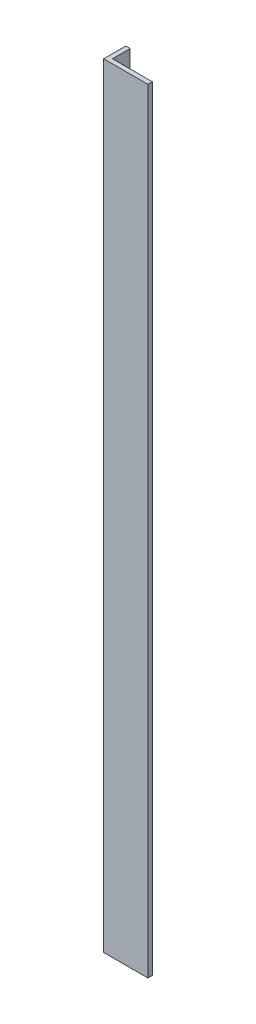
from build123d import *

# Parameters (mm, degrees)
BOSS_EXTRUDE1_DEPTH      = 300
BOSS_EXTRUDE1_DEPTH_BACK = 50
F_3_0_3_DIAMETER_HOLE3_D = 3
F_3_0_3_DIAMETER_HOLE4_D = 3


with BuildPart() as part:
    # Sketch1 → Boss-Extrude1 (new, two sides: drawn at the far end of the back side and taken through both)
    with BuildSketch(Plane(origin=(0, 0, 0), x_dir=(1, 0, 0), z_dir=(0, 1, 0)).offset(-BOSS_EXTRUDE1_DEPTH_BACK)):
        Polygon((0, 0), (0, 10), (2, 10), (2, 2), (20, 2), (20, 0), align=None)
    extrude(amount=BOSS_EXTRUDE1_DEPTH + BOSS_EXTRUDE1_DEPTH_BACK)

    # Ø3.0 (3) Diameter Hole3 (through all)
    with Locations(Plane(origin=(2, 311.407632793, -241.32004832), x_dir=(0, 0, 1), z_dir=(1, 0, 0))):
        with Locations((235.32004832, 355.407632793), (235.32004832, 341.407632793)):
            Hole(F_3_0_3_DIAMETER_HOLE3_D / 2)

    # Ø3.0 (3) Diameter Hole4 (through all)
    with Locations(Plane(origin=(2, 311.407632793, -241.32004832), x_dir=(0, 0, 1), z_dir=(1, 0, 0))):
        with Locations((235.32004832, 17.407632793), (235.32004832, 31.407632793)):
            Hole(F_3_0_3_DIAMETER_HOLE4_D / 2)


solid = part.part
